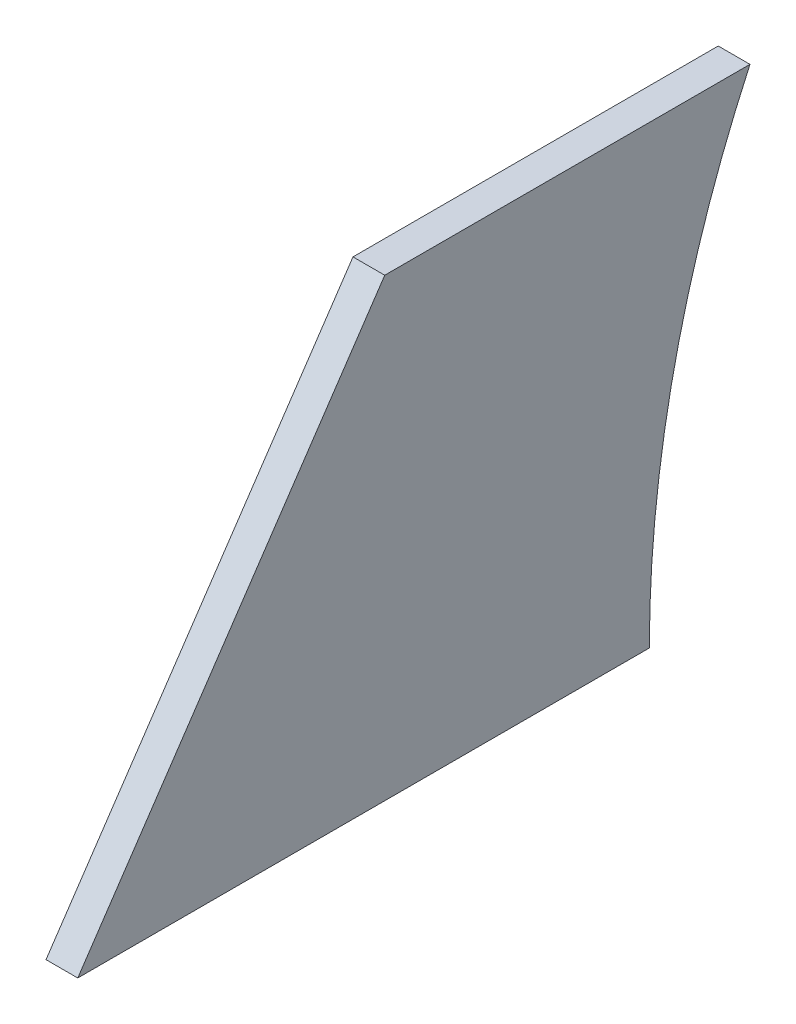
from build123d import *

# Parameters (mm, degrees)
EXTRUDE_1_DEPTH = 3


with BuildPart() as part:
    # Эскиз1 → Бобышка-Вытянуть1 (new body)
    with BuildSketch(Plane(origin=(0, 0, 0), x_dir=(0, 0, -1), z_dir=(1, 0, 0))):
        with BuildLine():
            Line((0, 0), (54, 0))
            ThreePointArc((54, 0), (56.405043336, 22.019187251), (63.506757004, 43))
            Line((63.506757004, 43), (29, 43))
            Line((29, 43), (0, 0))
        make_face()
    extrude(amount=EXTRUDE_1_DEPTH)


solid = part.part
